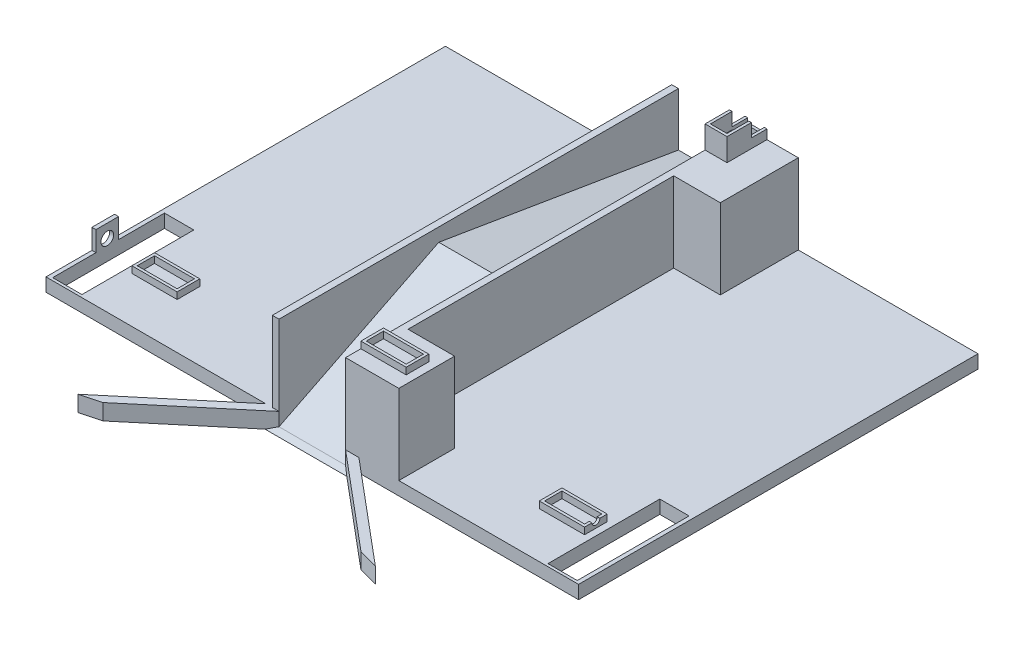
from build123d import *

# Parameters (mm, degrees)
BOSS_EXTRUDE3_DEPTH              = 10
SKETCH2_W                        = 34
SKETCH2_H                        = 17
SKETCH2_W_2                      = 30
SKETCH2_H_2                      = 13
BOSS_EXTRUDE4_DEPTH              = 5
SKETCH3_W                        = 50
SKETCH3_H                        = 120
BOSS_EXTRUDE5_DEPTH              = 50
CUT_EXTRUDE2_DEPTH               = 50
SKETCH5_W                        = 50
SKETCH5_H                        = 180
BOSS_EXTRUDE6_DEPTH              = 50
CUT_EXTRUDE3_DEPTH               = 348.630164486
SKETCH7_W                        = 5
SKETCH7_H                        = 300
BOSS_EXTRUDE7_DEPTH              = 70
SKETCH9_W                        = 34
SKETCH9_H                        = 17
SKETCH9_W_2                      = 30
SKETCH9_H_2                      = 13
BOSS_EXTRUDE8_DEPTH              = 5
SKETCH10_W                       = 58.550377391
SKETCH10_H                       = 60
BOSS_EXTRUDE9_DEPTH              = 35
SKETCH13_W                       = 16.5
SKETCH13_H                       = 30
SKETCH13_W_2                     = 12.5
SKETCH13_H_2                     = 26
BOSS_EXTRUDE11_DEPTH             = 7
BOSS_EXTRUDE16_DEPTH             = 10
BOSS_EXTRUDE16_DEPTH_BACK        = 2
BOSS_EXTRUDE19_DEPTH             = 2
BOSS_EXTRUDE23_REACH             = 352.964
BOSS_EXTRUDE23_DIRECTION_2_REACH = 352.964
SKETCH28_W                       = 3
SKETCH28_H                       = 10
BOSS_EXTRUDE24_DEPTH             = 85.999998
SKETCH30_W                       = 3
SKETCH30_H                       = 10
BOSS_EXTRUDE26_DEPTH             = 86
SKETCH32_W                       = 12.5
SKETCH32_H                       = 16.3
BOSS_EXTRUDE28_DEPTH             = 5
BOSS_EXTRUDE31_DEPTH             = 10
SKETCH35_W                       = 12.5
SKETCH35_H                       = 3
CUT_EXTRUDE4_DEPTH               = 2
CUT_EXTRUDE14_DEPTH              = 2
SKETCH41_W                       = 3
SKETCH41_H                       = 17
BOSS_EXTRUDE33_DEPTH             = 15
SKETCH42_R                       = 4.75
CUT_EXTRUDE11_DEPTH              = 3
SKETCH14_R                       = 8
BOSS_EXTRUDE34_DEPTH             = 5
SKETCH16_R                       = 8
BOSS_EXTRUDE35_DEPTH             = 5
SKETCH43_W                       = 2
SKETCH43_H                       = 10
BOSS_EXTRUDE36_DEPTH             = 22
BOSS_EXTRUDE37_REACH             = 465.482
SKETCH44_W                       = 2
SKETCH44_H                       = 10


with BuildPart() as part:
    # Sketch1 → Boss-Extrude3 (new body)
    with BuildSketch(Plane(origin=(0, 0, 0), x_dir=(1, 0, 0), z_dir=(0, 1, 0))):
        Polygon((-117.946551632, 258.11185804), (282.053448368, 258.11185804), (282.053448368, 44.11185804), (257.053448368, 44.11185804), (257.053448368, -41.88814196), (-92.946551632, -41.88814196), (-92.946551632, 44.11185804), (-117.946551632, 44.11185804), align=None)
    extrude(amount=BOSS_EXTRUDE3_DEPTH)

    # Sketch2 → Boss-Extrude4 (add)
    # profile 1 of 2: a face of its own
    with BuildSketch(Plane(origin=(0, 10, 0), x_dir=(1, 0, 0), z_dir=(0, 1, 0))):
        with Locations((-70.946551632, 1.11185804)):
            Rectangle(SKETCH2_W, SKETCH2_H)
        with Locations((-70.946551632, 1.11185804)):
            Rectangle(SKETCH2_W_2, SKETCH2_H_2, mode=Mode.SUBTRACT)
    # profile 2 of 2: a face of its own
    with BuildSketch(Plane(origin=(0, 10, 0), x_dir=(1, 0, 0), z_dir=(0, 1, 0))):
        with Locations((235.053448368, 1.11185804)):
            Rectangle(SKETCH2_W, SKETCH2_H)
        with Locations((235.053448368, 1.11185804)):
            Rectangle(SKETCH2_W_2, SKETCH2_H_2, mode=Mode.SUBTRACT)
    extrude(amount=BOSS_EXTRUDE4_DEPTH)

    # Sketch3 → Boss-Extrude5 (add)
    with BuildSketch(Plane(origin=(0, 10, 0), x_dir=(1, 0, 0), z_dir=(0, 1, 0))):
        with Locations((82.053448368, 18.11185804)):
            Rectangle(SKETCH3_W, SKETCH3_H)
    extrude(amount=BOSS_EXTRUDE5_DEPTH)

    # Sketch4 → Cut-Extrude2 (cut)
    with BuildSketch(Plane(origin=(107.053448368, 0, 0), x_dir=(0, 0, -1), z_dir=(1, 0, 0))):
        Polygon((-41.88814196, 60), (78.11185804, 60), (-41.88814196, 0), align=None)
    extrude(amount=-CUT_EXTRUDE2_DEPTH, mode=Mode.SUBTRACT)

    # Sketch5 → Boss-Extrude6 (add)
    with BuildSketch(Plane(origin=(0, 10, 0), x_dir=(1, 0, 0), z_dir=(0, 1, 0))):
        with Locations((82.053448368, 168.11185804)):
            Rectangle(SKETCH5_W, SKETCH5_H)
    extrude(amount=BOSS_EXTRUDE6_DEPTH)

    # Sketch6 → Cut-Extrude3 (cut, through all)
    with BuildSketch(Plane(origin=(107.053448368, 0, 0), x_dir=(0, 0, -1), z_dir=(1, 0, 0))):
        Polygon((78.11185804, 60), (258.11185804, 60), (258.11185804, 30), align=None)
    extrude(amount=-CUT_EXTRUDE3_DEPTH, mode=Mode.SUBTRACT)

    # Sketch7 → Boss-Extrude7 (add)
    with BuildSketch(Plane(origin=(0, 0, 0), x_dir=(1, 0, 0), z_dir=(0, 1, 0))):
        with Locations((54.553448368, 108.11185804)):
            Rectangle(SKETCH7_W, SKETCH7_H)
        Polygon((112.053448368, 258.11185804), (107.053448368, 258.11185804), (107.053448368, -41.88814196), (147.053448368, -41.88814196), (147.053448368, 0), (112.053448368, 0), align=None)
    extrude(amount=BOSS_EXTRUDE7_DEPTH)

    # Sketch9 → Boss-Extrude8 (add)
    with BuildSketch(Plane(origin=(0, 70, 0), x_dir=(1, 0, 0), z_dir=(0, 1, 0))):
        with Locations((124.053448368, -21.88814196)):
            Rectangle(SKETCH9_W, SKETCH9_H)
        with Locations((124.053448368, -21.88814196)):
            Rectangle(SKETCH9_W_2, SKETCH9_H_2, mode=Mode.SUBTRACT)
    extrude(amount=BOSS_EXTRUDE8_DEPTH)

    # Sketch10 → Boss-Extrude9 (add)
    with BuildSketch(Plane(origin=(112.053448368, 0, 0), x_dir=(0, 0, -1), z_dir=(1, 0, 0))):
        with Locations((228.836669345, 40)):
            Rectangle(SKETCH10_W, SKETCH10_H)
    extrude(amount=BOSS_EXTRUDE9_DEPTH)

    # Sketch13 → Boss-Extrude11 (add)
    with BuildSketch(Plane(origin=(0, 70, 0), x_dir=(1, 0, 0), z_dir=(0, 1, 0))):
        with Locations((115.303448368, 243.11185804)):
            Rectangle(SKETCH13_W, SKETCH13_H)
        with Locations((115.303448368, 243.11185804)):
            Rectangle(SKETCH13_W_2, SKETCH13_H_2, mode=Mode.SUBTRACT)
    extrude(amount=BOSS_EXTRUDE11_DEPTH)

    # Sketch20 → Boss-Extrude16 (add, two sides: drawn at the far end of the back side and taken through both)
    with BuildSketch(Plane(origin=(0, 0, 0), x_dir=(1, 0, 0), z_dir=(0, 1, 0)).offset(-BOSS_EXTRUDE16_DEPTH_BACK)):
        Polygon((47.053448368, -41.88814196), (-29.550995944, -106.166902929), (-14.859601624, -102.230355685), (57.053448368, -41.88814196), align=None)
        Polygon((107.053448368, -41.88814196), (178.96649836, -102.230355685), (193.65789268, -106.166902929), (117.053448368, -41.88814196), align=None)
    extrude(amount=BOSS_EXTRUDE16_DEPTH + BOSS_EXTRUDE16_DEPTH_BACK)

    # Sketch21 → Boss-Extrude19 (add)
    with BuildSketch(Plane.XZ):
        Polygon((57.053448368, 41.88814196), (107.053448368, 41.88814196), (117.053448368, 41.88814196), (117.053448368, 31.88814196), (107.053448368, 31.88814196), (107.053448368, 11.88814196), (57.053448368, 11.88814196), (57.053448368, 31.88814196), (47.053448368, 31.88814196), (47.053448368, 41.88814196), align=None)
    extrude(amount=BOSS_EXTRUDE19_DEPTH)


with BuildPart() as body_2:

    # Boss-Extrude23: up to this face of the body (flat: up to its plane)
    boss_extrude23_end = Plane(part.part.faces().sort_by_distance((21.096923372, 4, 72.059248823))[0])
    # Sketch23 → Boss-Extrude23 (new, up to the picked face)
    with BuildSketch(Plane(origin=(107.053448368, 0, 0), x_dir=(0, 0, -1), z_dir=(1, 0, 0)), mode=Mode.PRIVATE) as boss_extrude23_sk1:
        Polygon((-41.88814196, 0), (-46.68814196, -2), (-41.88814196, -2), align=None)
    boss_extrude23_tool1 = split(extrude(boss_extrude23_sk1.sketch, amount=-BOSS_EXTRUDE23_REACH, mode=Mode.PRIVATE), bisect_by=boss_extrude23_end, keep=Keep.BOTH, mode=Mode.PRIVATE)
    add(boss_extrude23_tool1.solids().sort_by(Axis((107.053448, -1.333333, 43.488142), (-1, 0, 0)))[0])


    # Boss-Extrude23 direction 2: up to this face of the body (flat: up to its plane)
    boss_extrude23_direction_2_end = Plane(part.part.faces().sort_by_distance((143.009973364, 4, 72.059248823))[0])
    # Sketch23 → Boss-Extrude23 direction 2 (add, up to the picked face)
    with BuildSketch(Plane(origin=(107.053448368, 0, 0), x_dir=(0, 0, -1), z_dir=(1, 0, 0)), mode=Mode.PRIVATE) as boss_extrude23_direction_2_sk1:
        Polygon((-41.88814196, 0), (-46.68814196, -2), (-41.88814196, -2), align=None)
    boss_extrude23_direction_2_tool1 = split(extrude(boss_extrude23_direction_2_sk1.sketch, amount=BOSS_EXTRUDE23_DIRECTION_2_REACH, mode=Mode.PRIVATE), bisect_by=boss_extrude23_direction_2_end, keep=Keep.BOTH, mode=Mode.PRIVATE)
    add(boss_extrude23_direction_2_tool1.solids().sort_by(Axis((107.053448, -1.333333, 43.488142), (1, 0, 0)))[0])


with BuildPart() as part_1:
    add(part.part)

    # Sketch28 → Boss-Extrude24 (add)
    with BuildSketch(Plane.XY.offset(-44.11185804)):
        with Locations((-116.446551632, 5)):
            Rectangle(SKETCH28_W, SKETCH28_H)
    extrude(amount=BOSS_EXTRUDE24_DEPTH)

    # Sketch30 → Boss-Extrude26 (add)
    with BuildSketch(Plane.XY.offset(-44.11185804)):
        with Locations((280.553448368, 5)):
            Rectangle(SKETCH30_W, SKETCH30_H)
    extrude(amount=BOSS_EXTRUDE26_DEPTH)

    # Sketch32 → Boss-Extrude28 (add)
    with BuildSketch(Plane(origin=(0, 70, 0), x_dir=(1, 0, 0), z_dir=(0, 1, 0))):
        with Locations((115.303448368, 238.26185804)):
            Rectangle(SKETCH32_W, SKETCH32_H)
    extrude(amount=BOSS_EXTRUDE28_DEPTH)

    # Sketch34 → Boss-Extrude31 (add)
    with BuildSketch(Plane(origin=(0, 77, 0), x_dir=(1, 0, 0), z_dir=(0, 1, 0))):
        Polygon((109.053448368, 246.41185804), (107.053448368, 246.41185804), (107.053448368, 228.11185804), (123.553448368, 228.11185804), (123.553448368, 246.41185804), (121.553448368, 246.41185804), (121.553448368, 230.11185804), (109.053448368, 230.11185804), align=None)
    extrude(amount=BOSS_EXTRUDE31_DEPTH)

    # Sketch35 → Cut-Extrude4 (cut)
    with BuildSketch(Plane(origin=(0, 0, -258.11185804), x_dir=(-1, 0, 0), z_dir=(0, 0, -1))):
        with Locations((-115.303448368, 75.5)):
            Rectangle(SKETCH35_W, SKETCH35_H)
    extrude(amount=-CUT_EXTRUDE4_DEPTH, mode=Mode.SUBTRACT)

    # Sketch47 → Cut-Extrude14 (cut)
    with BuildSketch(Plane(origin=(252.053448368, 0, 0), x_dir=(0, 0, -1), z_dir=(1, 0, 0))):
        with BuildLine():
            Line((-1.88814196, 15), (4.11185804, 15))
            ThreePointArc((4.11185804, 15), (1.11185804, 12), (-1.88814196, 15))
        make_face()
    extrude(amount=-CUT_EXTRUDE14_DEPTH, mode=Mode.SUBTRACT)

    # Sketch41 → Boss-Extrude33 (add)
    with BuildSketch(Plane(origin=(0, 10, 0), x_dir=(1, 0, 0), z_dir=(0, 1, 0))):
        with Locations((-116.446551632, 1.11185804)):
            Rectangle(SKETCH41_W, SKETCH41_H)
    extrude(amount=BOSS_EXTRUDE33_DEPTH)

    # Sketch42 → Cut-Extrude11 (cut)
    with BuildSketch(Plane.ZY.offset(117.946551632)):
        with Locations((-1.11185804, 15)):
            Circle(SKETCH42_R)
    extrude(amount=-CUT_EXTRUDE11_DEPTH, mode=Mode.SUBTRACT)

    # Sketch14 → Boss-Extrude34 (add)
    with BuildSketch(Plane.XZ):
        with Locations(Location((267.053448368, -243.11185804, 0), (0, 0, 90))):
            Circle(SKETCH14_R)
    extrude(amount=BOSS_EXTRUDE34_DEPTH)

    # Sketch16 → Boss-Extrude35 (add)
    with BuildSketch(Plane.XZ):
        with Locations(Location((-102.946551632, -243.11185804, 0), (0, 0, 90))):
            Circle(SKETCH16_R)
    extrude(amount=BOSS_EXTRUDE35_DEPTH)

    # Sketch43 → Boss-Extrude36 (add)
    with BuildSketch(Plane.ZY.offset(92.946551632)):
        with Locations((40.88814196, 5)):
            Rectangle(SKETCH43_W, SKETCH43_H)
    extrude(amount=BOSS_EXTRUDE36_DEPTH)

    # Sketch44 → Boss-Extrude37 (add, up to next)
    with BuildSketch(Plane(origin=(257.053448368, 0, 0), x_dir=(0, 0, -1), z_dir=(1, 0, 0)), mode=Mode.PRIVATE) as boss_extrude37_sk1:
        with Locations((-40.88814196, 5)):
            Rectangle(SKETCH44_W, SKETCH44_H)
    boss_extrude37_tool1 = extrude(boss_extrude37_sk1.sketch, amount=BOSS_EXTRUDE37_REACH, mode=Mode.PRIVATE) - part_1.part
    add(boss_extrude37_tool1.solids().sort_by_distance((257.053448, 5, 40.888142))[0])


solid = Compound([body_2.part, part_1.part])
